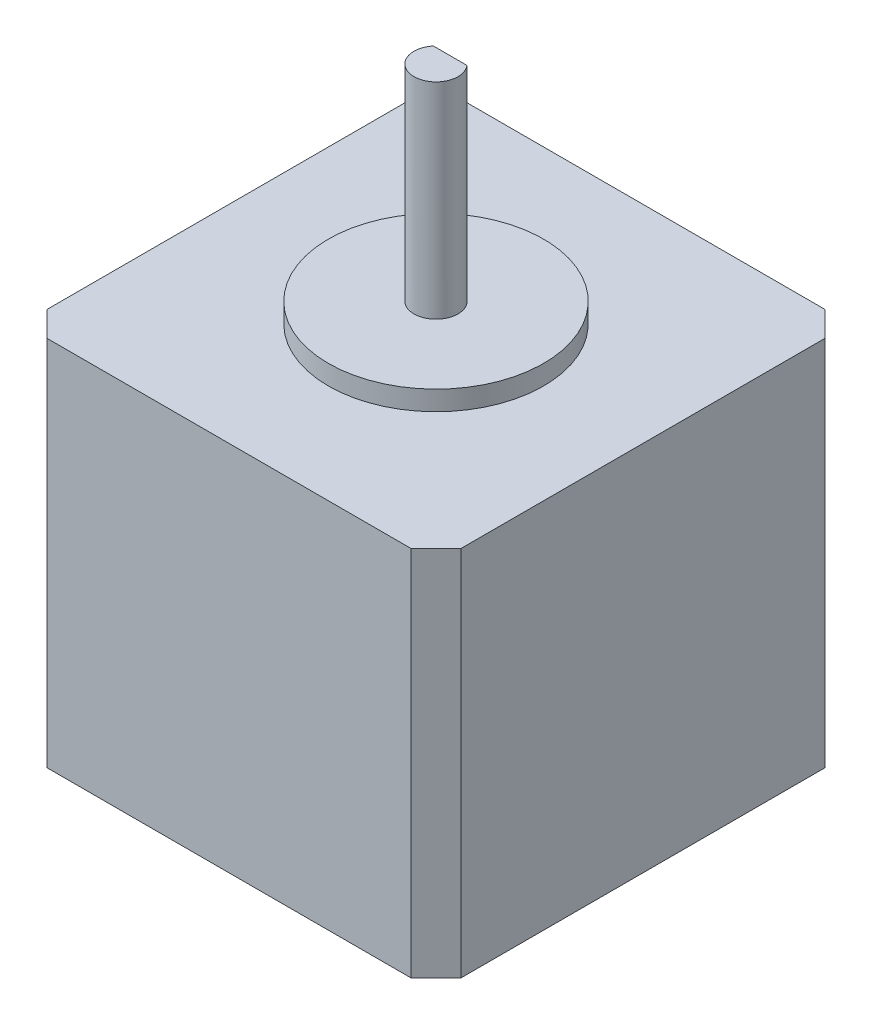
from build123d import *

# Parameters (mm, degrees)
SKETCH1_W           = 42.299999982
SKETCH1_H           = 42.3
BOSS_EXTRUDE1_DEPTH = 38
CHAMFER1_SIZE       = 2.54
SKETCH2_R           = 11
BOSS_EXTRUDE2_DEPTH = 2
SKETCH3_R           = 2.25
BOSS_EXTRUDE3_DEPTH = 21
SKETCH4_W           = 3.436789712
SKETCH4_H           = 1.59509441
CUT_EXTRUDE1_DEPTH  = 18


with BuildPart() as part:
    # Sketch1 → Boss-Extrude1 (new body)
    with BuildSketch(Plane(origin=(0, 0, 0), x_dir=(1, 0, 0), z_dir=(0, 1, 0))):
        Rectangle(SKETCH1_W, SKETCH1_H)
    extrude(amount=BOSS_EXTRUDE1_DEPTH)

    # Chamfer1
    chamfer1_edges = [part.edges().sort_by_distance(p)[0] for p in [
        (21.149999991, 19, 21.15),
        (-21.149999991, 19, 21.15),
        (-21.149999991, 19, -21.15),
        (21.149999991, 19, -21.15),
    ]]
    chamfer(chamfer1_edges, length=CHAMFER1_SIZE)

    # Sketch2 → Boss-Extrude2 (add)
    with BuildSketch(Plane(origin=(0, 38, 0), x_dir=(1, 0, 0), z_dir=(0, 1, 0))):
        with Locations(Location((0, 0, 0), (0, 0, 270))):
            Circle(SKETCH2_R)
    extrude(amount=BOSS_EXTRUDE2_DEPTH)

    # Sketch3 → Boss-Extrude3 (add)
    with BuildSketch(Plane(origin=(0, 40, 0), x_dir=(1, 0, 0), z_dir=(0, 1, 0))):
        with Locations(Location((0, 0, 0), (0, 0, 90))):
            Circle(SKETCH3_R)
    extrude(amount=BOSS_EXTRUDE3_DEPTH)

    # Sketch4 → Cut-Extrude1 (cut)
    with BuildSketch(Plane(origin=(0, 61, 0), x_dir=(1, 0, 0), z_dir=(0, 1, 0))):
        with Locations((0, 2.25)):
            Rectangle(SKETCH4_W, SKETCH4_H)
    extrude(amount=-CUT_EXTRUDE1_DEPTH, mode=Mode.SUBTRACT)


solid = part.part
